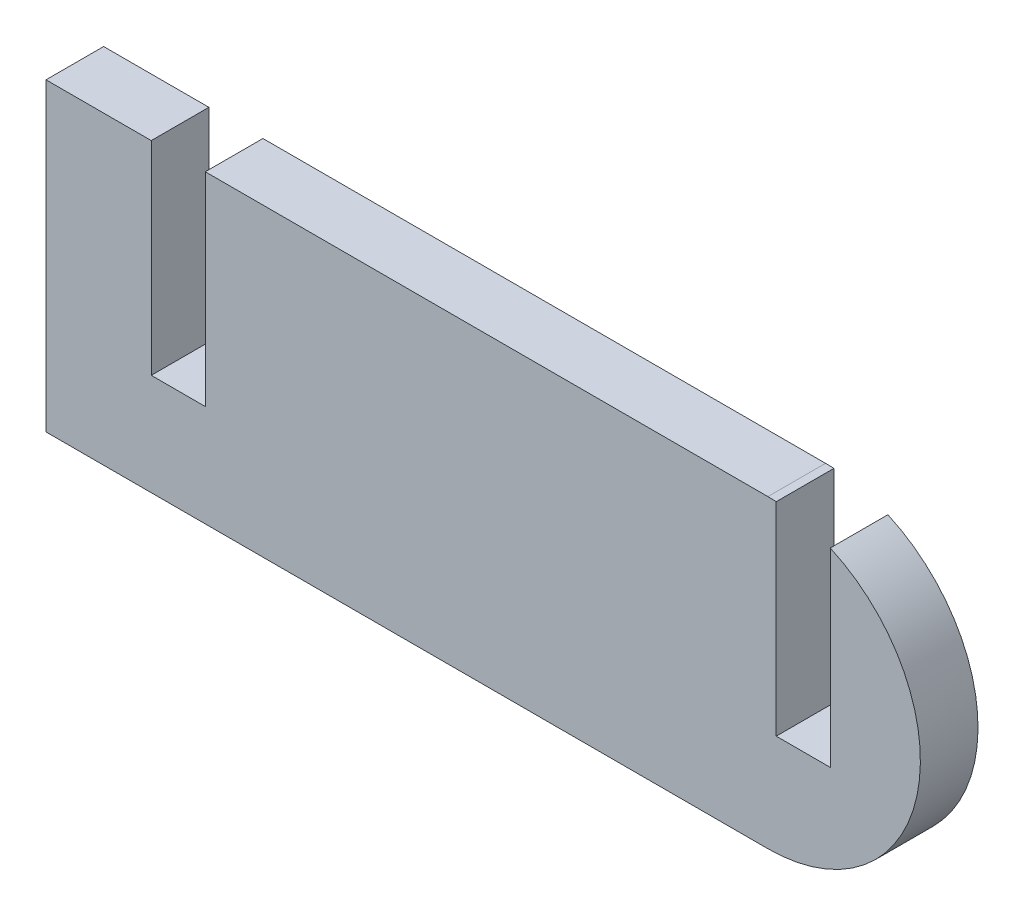
from build123d import *

# Parameters (mm, degrees)
SKETCH1_W           = 76.2
SKETCH1_H           = 25.4
BOSS_EXTRUDE1_DEPTH = 4.800000052
CUT_EXTRUDE2_DEPTH  = 142.571180171
SKETCH2_W           = 4.500000144
SKETCH2_H           = 16.933333333
CUT_EXTRUDE3_DEPTH  = 142.571180171
SKETCH7_W           = 4.500000144
SKETCH7_H           = 16.933333333
CUT_EXTRUDE4_DEPTH  = 142.571180171
SKETCH8_W           = 0.723333241
SKETCH8_H           = 25.4
CUT_EXTRUDE5_DEPTH  = 142.571180171


with BuildPart() as part:
    # Sketch1 → Boss-Extrude1 (new body)
    with BuildSketch(Plane.XY):
        with Locations((-50.643719603, -97.499415994)):
            Rectangle(SKETCH1_W, SKETCH1_H)
    extrude(amount=BOSS_EXTRUDE1_DEPTH)

    # Sketch6 → Cut-Extrude2 (cut, through all)
    with BuildSketch(Plane.XY.offset(4.800000052)):
        with BuildLine():
            Line((-27.897719629, -110.199415994), (-12.543719603, -110.199415994))
            Line((-12.543719603, -110.199415994), (-12.543719603, -84.799415994))
            Line((-12.543719603, -84.799415994), (-27.897719629, -84.799415994))
            ThreePointArc((-27.897719629, -84.799415994), (-15.197719629, -97.499415994), (-27.897719629, -110.199415994))
        make_face()
    extrude(amount=-CUT_EXTRUDE2_DEPTH, mode=Mode.SUBTRACT)

    # Sketch2 → Cut-Extrude3 (cut, through all)
    with BuildSketch(Plane.XY.offset(4.800000052)):
        with Locations((-24.953719675, -93.266082661)):
            Rectangle(SKETCH2_W, SKETCH2_H)
    extrude(amount=-CUT_EXTRUDE3_DEPTH, mode=Mode.SUBTRACT)

    # Sketch7 → Cut-Extrude4 (cut, through all)
    with BuildSketch(Plane(origin=(0, 0, 0), x_dir=(-1, 0, 0), z_dir=(0, 0, -1))):
        with Locations((77.003719715, -93.266082661)):
            Rectangle(SKETCH7_W, SKETCH7_H)
    extrude(amount=-CUT_EXTRUDE4_DEPTH, mode=Mode.SUBTRACT)

    # Sketch8 → Cut-Extrude5 (cut, through all)
    with BuildSketch(Plane(origin=(0, 0, 0), x_dir=(-1, 0, 0), z_dir=(0, 0, -1))):
        with Locations((88.382052982, -97.499415994)):
            Rectangle(SKETCH8_W, SKETCH8_H)
    extrude(amount=-CUT_EXTRUDE5_DEPTH, mode=Mode.SUBTRACT)


solid = part.part
